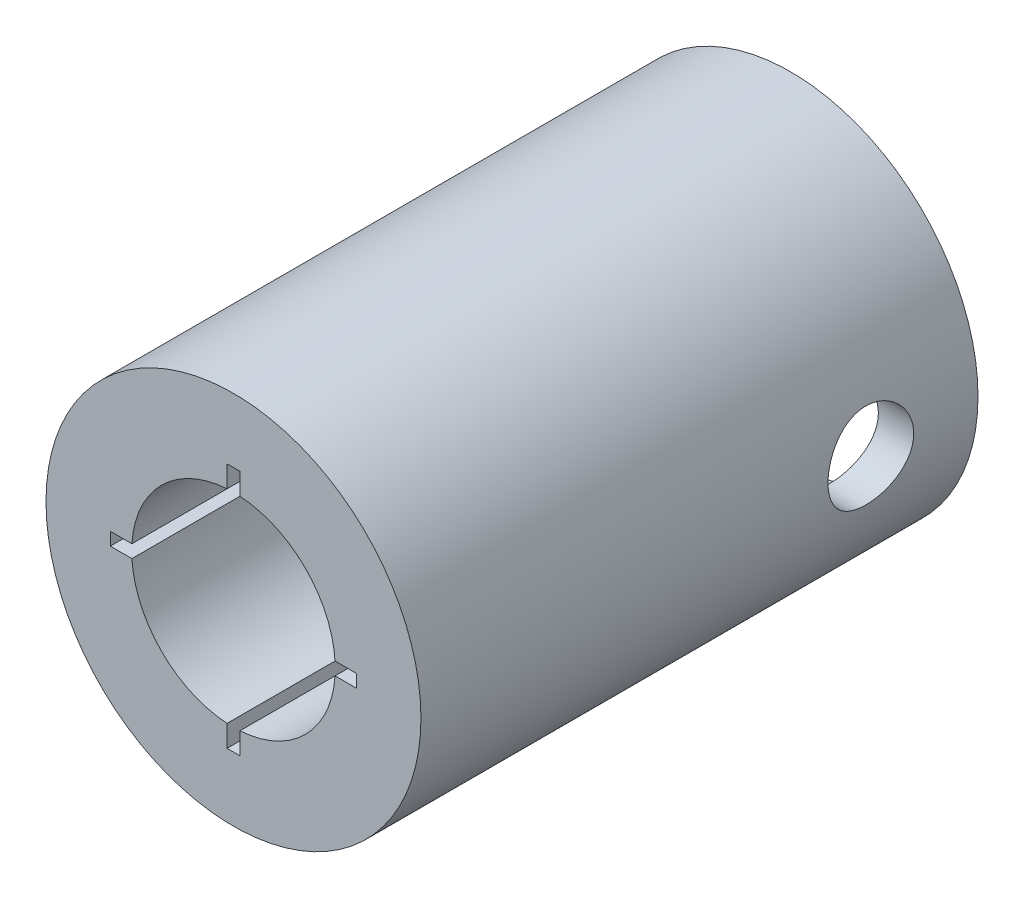
from build123d import *

# Parameters (mm, degrees)
SKETCH_1_R               = 8.75
SKETCH_1_R_2             = 7.1
EXTRUDE_1_DEPTH          = 10
CUT_EXTRUDE_1_DEPTH      = 20
CUT_EXTRUDE_1_DEPTH_BACK = 10
SKETCH_2_R               = 2
SKETCH_3_R               = 8.75
SKETCH_3_R_2             = 4.75
EXTRUDE_2_DEPTH          = 16
CUT_EXTRUDE_START        = -8
CUT_EXTRUDE_2_DEPTH      = 8


with BuildPart() as part:
    # 草图1 → 凸台-拉伸1 (new body)
    with BuildSketch(Plane.XY):
        Circle(SKETCH_1_R)
        Circle(SKETCH_1_R_2, mode=Mode.SUBTRACT)
    extrude(amount=EXTRUDE_1_DEPTH)

    # 草图2 → 切除-拉伸1 (cut, two sides: drawn at the far end of the back side and taken through both)
    with BuildSketch(Plane(origin=(0, 0, 0), x_dir=(0, 0, -1), z_dir=(1, 0, 0)).offset(-CUT_EXTRUDE_1_DEPTH_BACK)):
        with Locations((-5, 0)):
            Circle(SKETCH_2_R)
    extrude(amount=CUT_EXTRUDE_1_DEPTH + CUT_EXTRUDE_1_DEPTH_BACK, mode=Mode.SUBTRACT)

    # 草图3 → 凸台-拉伸2 (add)
    with BuildSketch(Plane.XY.offset(10)):
        Circle(SKETCH_3_R)
        Circle(SKETCH_3_R_2, mode=Mode.SUBTRACT)
    extrude(amount=EXTRUDE_2_DEPTH)

    # 草图4 → 切除-拉伸2 (cut)
    with BuildSketch(Plane.XY.offset(26).offset(CUT_EXTRUDE_START)):
        with BuildLine():
            Line((-0.3, -4.740516849), (-0.3, -5.75))
            Line((-0.3, -5.75), (0.3, -5.75))
            Line((0.3, -5.75), (0.3, -4.740516849))
            ThreePointArc((0.3, -4.740516849), (0, -4.75), (-0.3, -4.740516849))
        make_face()
        with BuildLine():
            Line((-5.75, -0.3), (-4.740516849, -0.3))
            ThreePointArc((-4.740516849, -0.3), (-4.75, 0), (-4.740516849, 0.3))
            Line((-4.740516849, 0.3), (-5.75, 0.3))
            Line((-5.75, 0.3), (-5.75, -0.3))
        make_face()
        with BuildLine():
            Line((-0.3, 5.75), (-0.3, 4.740516849))
            ThreePointArc((-0.3, 4.740516849), (0, 4.75), (0.3, 4.740516849))
            Line((0.3, 4.740516849), (0.3, 5.75))
            Line((0.3, 5.75), (-0.3, 5.75))
        make_face()
        with BuildLine():
            Line((5.75, 0.3), (4.740516849, 0.3))
            ThreePointArc((4.740516849, 0.3), (4.75, 0), (4.740516849, -0.3))
            Line((4.740516849, -0.3), (5.75, -0.3))
            Line((5.75, -0.3), (5.75, 0.3))
        make_face()
    extrude(amount=CUT_EXTRUDE_2_DEPTH, mode=Mode.SUBTRACT)


solid = part.part
